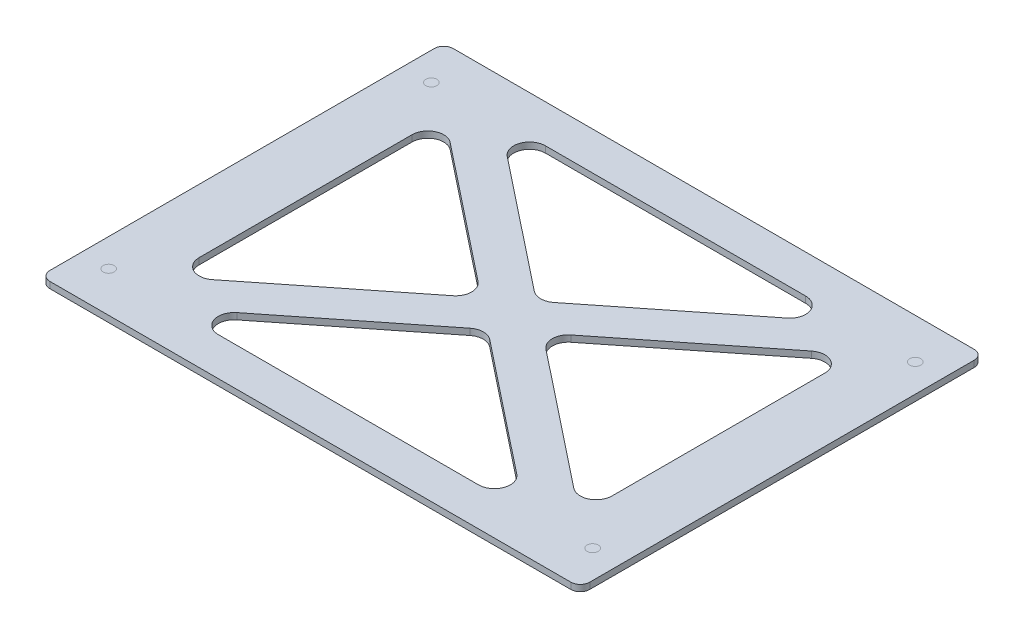
from build123d import *

# Parameters (mm, degrees)
SKETCH1_W           = 170
SKETCH1_H           = 127
BOSS_EXTRUDE1_DEPTH = 2
FILLET1_R           = 5
FILLET2_R           = 3
SKETCH2_R           = 1.75
CUT_EXTRUDE1_DEPTH  = 0.001
FILLET3_R           = 5


with BuildPart() as part:
    # Sketch1 → Boss-Extrude1 (new body)
    with BuildSketch(Plane(origin=(0, 0, 0), x_dir=(1, 0, 0), z_dir=(0, 1, 0))):
        with Locations((0.791433892, -6.955632319)):
            Rectangle(SKETCH1_W, SKETCH1_H)
        Polygon((-54.546913293, 44.544367681), (56.129781077, 44.544367681), (0.791433892, 0.699369526), align=None, mode=Mode.SUBTRACT)
        Polygon((-64.208566108, 36.889365836), (-64.208566108, -50.800630474), (-8.870218923, -6.955632319), align=None, mode=Mode.SUBTRACT)
        Polygon((-54.546913293, -58.455632319), (56.129781077, -58.455632319), (0.791433892, -14.610634164), align=None, mode=Mode.SUBTRACT)
        Polygon((65.791433892, 36.889365836), (65.791433892, -50.800630474), (10.453086707, -6.955632319), align=None, mode=Mode.SUBTRACT)
    extrude(amount=BOSS_EXTRUDE1_DEPTH)

    # Fillet1
    fillet1_edges = [part.edges().sort_by_distance(p)[0] for p in [
        (0.791433892, 1, -0.699369526),
        (56.129781077, 1, -44.544367681),
        (-54.546913293, 1, -44.544367681),
        (10.453086707, 1, 6.955632319),
        (65.791433892, 1, 50.800630474),
        (65.791433892, 1, -36.889365836),
        (-8.870218923, 1, 6.955632319),
        (-64.208566108, 1, -36.889365836),
        (-64.208566108, 1, 50.800630474),
        (56.129781077, 1, 58.455632319),
        (0.791433892, 1, 14.610634164),
    ]]
    fillet(fillet1_edges, radius=FILLET1_R)

    # Fillet2
    fillet2_edges = [part.edges().sort_by_distance(p)[0] for p in [
        (-84.208566108, 1, -56.544367681),
        (85.791433892, 1, -56.544367681),
        (85.791433892, 1, 70.455632319),
        (-84.208566108, 1, 70.455632319),
    ]]
    fillet(fillet2_edges, radius=FILLET2_R)

    # Sketch2 → Cut-Extrude1 (cut)
    with BuildSketch(Plane(origin=(0, 2, 0), x_dir=(1, 0, 0), z_dir=(0, 1, 0))):
        with Locations(Location((-75.408566108, 43.844367681, 0), (0, 0, 270))):
            Circle(SKETCH2_R)
        with Locations(Location((76.991433892, 43.844367681, 0), (0, 0, 270))):
            Circle(SKETCH2_R)
        with Locations(Location((76.991433892, -57.755632319, 0), (0, 0, 270))):
            Circle(SKETCH2_R)
        with Locations(Location((-75.408566108, -57.755632319, 0), (0, 0, 270))):
            Circle(SKETCH2_R)
    extrude(amount=-CUT_EXTRUDE1_DEPTH, mode=Mode.SUBTRACT)

    # Fillet3
    fillet3_edges = [part.edges().sort_by_distance(p)[0] for p in [
        (-54.546913293, 1, 58.455632319),
    ]]
    fillet(fillet3_edges, radius=FILLET3_R)


solid = part.part
